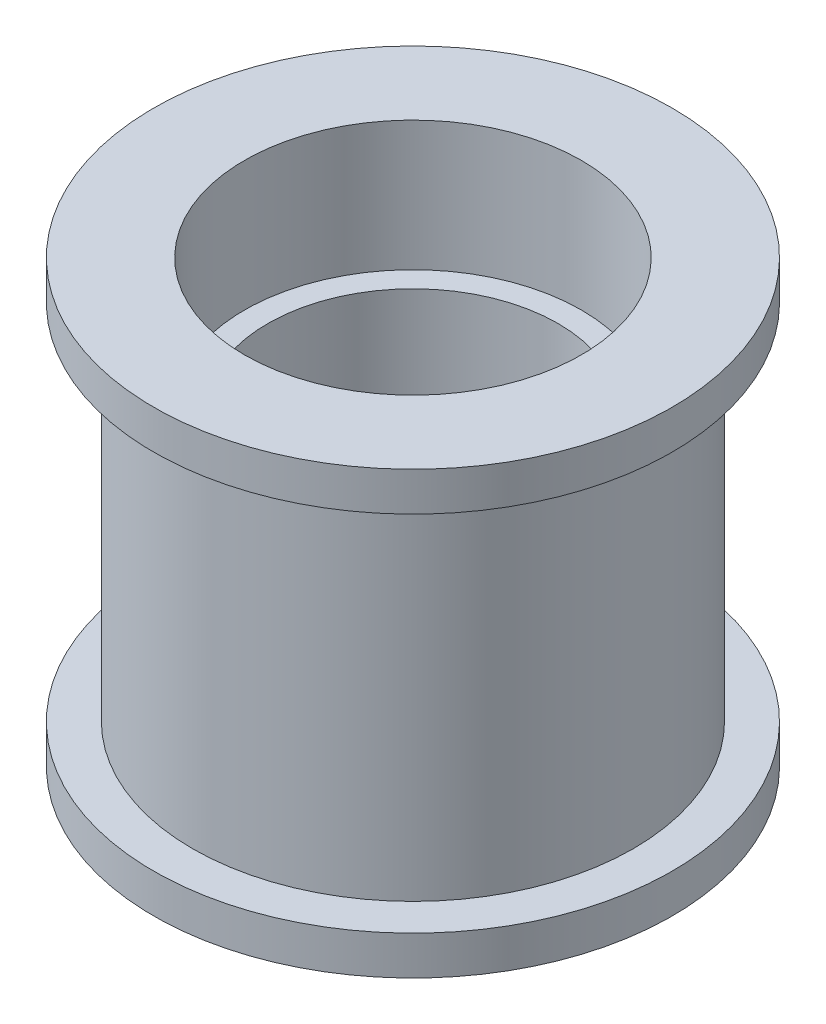
from build123d import *


with BuildPart() as part:
    # Эскиз1 → Повернуть1 (revolve)
    with BuildSketch(Plane.XY, mode=Mode.PRIVATE) as revolve_1_sk:
        Polygon((5.6, -3.5), (5.6, 3.5), (6.5, 3.5), (6.5, 8.5), (10, 8.5), (10, 7), (8.5, 7), (8.5, -7), (10, -7), (10, -8.5), (6.5, -8.5), (6.5, -3.5), align=None)
    revolve(revolve_1_sk.sketch.rotate(Axis((0, 0, 0), (0, 1, 0)), 90), axis=Axis((0, 0, 0), (0, 1, 0)))


solid = part.part
